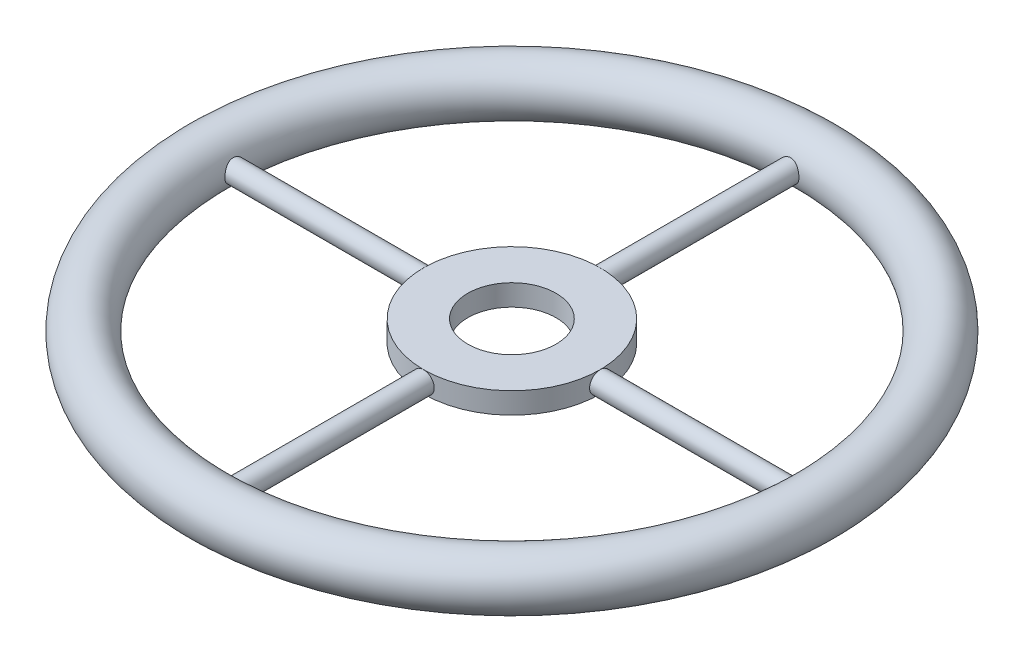
from build123d import *
from build123d.topology import SkipClean

# Parameters (mm, degrees)
SKETCH1_R           = 7.5
SKETCH7_R           = 25
SKETCH7_R_2         = 12.5
BOSS_EXTRUDE1_DEPTH = 3
SKETCH9_R           = 3
BOSS_EXTRUDE2_DEPTH = 60
CIRPATTERN1_COUNT   = 4


with BuildPart() as part:
    # Sketch1 → Revolve1 (revolve)
    with BuildSketch(Plane(origin=(0, 0, 0), x_dir=(0, 0, -1), z_dir=(1, 0, 0)), mode=Mode.PRIVATE) as revolve1_sk:
        with Locations((85.847663828, 0)):
            Circle(SKETCH1_R)
    revolve(revolve1_sk.sketch.rotate(Axis((0, 23.315247053, 0), (0, -1, 0)), 180), axis=Axis((0, 23.315247053, 0), (0, -1, 0)))

    # Sketch9 → Boss-Extrude2 (add)
    with SkipClean():  # the faces are left unmerged after this step: merging them gives an invalid solid
        with BuildSketch(Plane(origin=(25, 0, 0), x_dir=(0, 0, -1), z_dir=(1, 0, 0))):
            with Locations(Location((0, 0, 0), (0, 0, 320.372268836))):
                Circle(SKETCH9_R)
        boss_extrude2 = extrude(amount=BOSS_EXTRUDE2_DEPTH)

    # CirPattern1: Boss-Extrude2 ×4 about axis
    with SkipClean():  # the faces are left unmerged after this step: merging them gives an invalid solid
        cirpattern1_axis = Axis((0, 0, 0), (0, 1, 0))
        for i in range(1, CIRPATTERN1_COUNT):
            add(boss_extrude2.rotate(cirpattern1_axis, i * 360 / CIRPATTERN1_COUNT))


with BuildPart() as body_2:
    # Sketch7 → Boss-Extrude1 (new, symmetric)
    with BuildSketch(Plane(origin=(0, 0, 0), x_dir=(1, 0, 0), z_dir=(0, 1, 0))):
        with Locations(Location((0, 0, 0), (0, 0, 270))):
            Circle(SKETCH7_R)
        with Locations(Location((0, 0, 0), (0, 0, 270))):
            Circle(SKETCH7_R_2, mode=Mode.SUBTRACT)
    extrude(amount=BOSS_EXTRUDE1_DEPTH, both=True)


solid = Compound([part.part, body_2.part])
